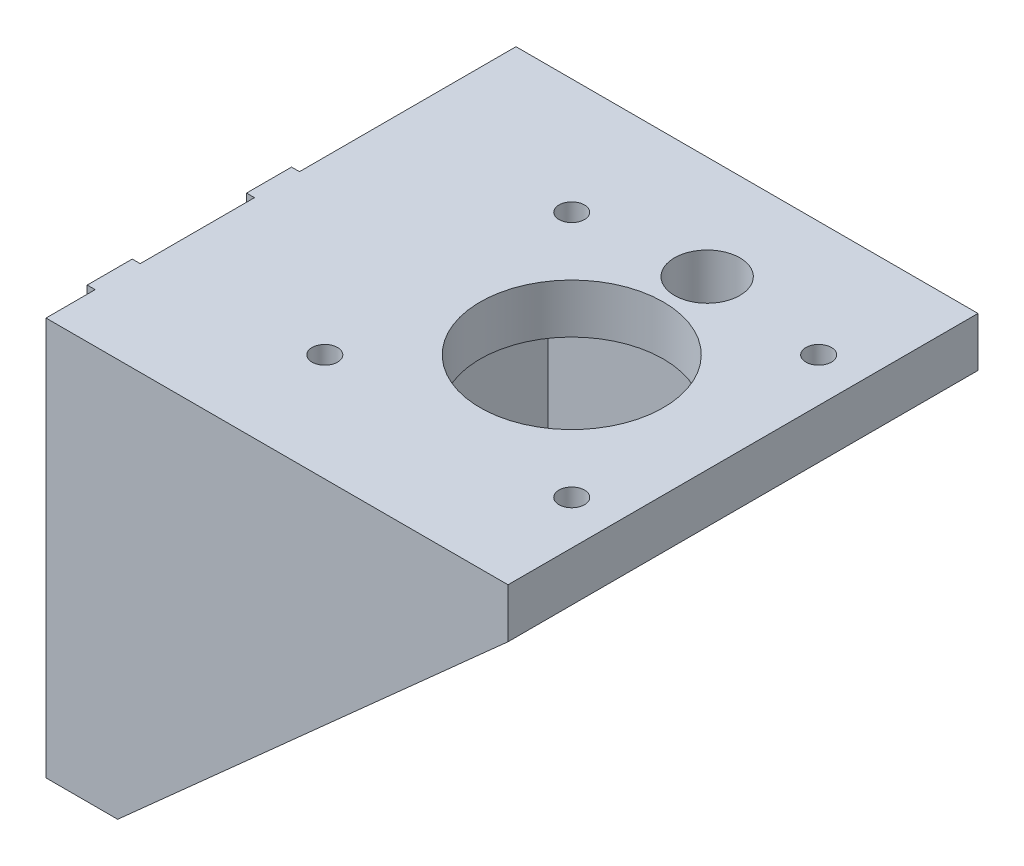
from build123d import *

# Parameters (mm, degrees)
RESSALTO_EXTRUS_O1_DEPTH = 59
ESBO_O2_W                = 50
ESBO_O2_H                = 43.8
CORTE_EXTRUS_O1_DEPTH    = 49
ESBO_O3_R                = 1.75
CORTE_EXTRUS_O2_DEPTH    = 92.553263186
ESBO_O4_W                = 5.65
ESBO_O4_H                = 50
ESBO_O4_R                = 1.75
RESSALTO_EXTRUS_O2_DEPTH = 1
ESBO_O5_R                = 4.35
CORTE_EXTRUS_O3_DEPTH    = 4
ESBO_O6_R                = 11.5
ESBO_O6_R_2              = 1.6
ESBO_O6_R_3              = 4.1
CORTE_EXTRUS_O4_DEPTH    = 6.2
ESBO_O7_W                = 146.645029728
ESBO_O7_H                = 95.479941405
CORTE_EXTRUS_O5_DEPTH    = 139


with BuildPart() as part:
    # Esboço1 → Ressalto-extrusão1 (new body)
    with BuildSketch(Plane.XY):
        Polygon((9, 0), (58, 43.8), (58, 50), (0, 50), (0, 0), align=None)
    extrude(amount=RESSALTO_EXTRUS_O1_DEPTH)

    # Esboço2 → Corte-extrusão1 (cut)
    with BuildSketch(Plane(origin=(58, 0, 0), x_dir=(0, 0, -1), z_dir=(1, 0, 0))):
        with Locations((-29, 21.9)):
            Rectangle(ESBO_O2_W, ESBO_O2_H)
    extrude(amount=-CORTE_EXTRUS_O1_DEPTH, mode=Mode.SUBTRACT)

    # Esboço3 → Corte-extrusão2 (cut, through all)
    with BuildSketch(Plane(origin=(9, 0, 0), x_dir=(0, 0, -1), z_dir=(1, 0, 0))):
        with Locations((-29, 11.9)):
            Circle(ESBO_O3_R)
        with Locations((-29, 31.9)):
            Circle(ESBO_O3_R)
        with Locations((-9, 31.9)):
            Circle(ESBO_O3_R)
        with Locations((-9, 11.9)):
            Circle(ESBO_O3_R)
    extrude(amount=-CORTE_EXTRUS_O2_DEPTH, mode=Mode.SUBTRACT)

    # Esboço4 → Ressalto-extrusão2 (add)
    # profile 1 of 2: a face of its own
    with BuildSketch(Plane.ZY):
        with Locations((9, 25)):
            Rectangle(ESBO_O4_W, ESBO_O4_H)
        with Locations(Location((9, 11.9, 0), (0, 0, 180))):
            Circle(ESBO_O4_R, mode=Mode.SUBTRACT)
        with Locations(Location((9, 31.9, 0), (0, 0, 180))):
            Circle(ESBO_O4_R, mode=Mode.SUBTRACT)
    # profile 2 of 2: a face of its own
    with BuildSketch(Plane.ZY):
        with Locations((29, 25)):
            Rectangle(ESBO_O4_W, ESBO_O4_H)
        with Locations(Location((29, 11.9, 0), (0, 0, 180))):
            Circle(ESBO_O4_R, mode=Mode.SUBTRACT)
        with Locations(Location((29, 31.9, 0), (0, 0, 180))):
            Circle(ESBO_O4_R, mode=Mode.SUBTRACT)
    extrude(amount=RESSALTO_EXTRUS_O2_DEPTH)

    # Esboço5 → Corte-extrusão3 (cut)
    with BuildSketch(Plane(origin=(9, 0, 0), x_dir=(0, 0, -1), z_dir=(1, 0, 0))):
        with Locations((-29, 31.9)):
            Circle(ESBO_O5_R)
        with Locations((-9, 31.9)):
            Circle(ESBO_O5_R)
        with Locations((-29, 11.9)):
            Circle(ESBO_O5_R)
        with Locations((-9, 11.9)):
            Circle(ESBO_O5_R)
    extrude(amount=-CORTE_EXTRUS_O3_DEPTH, mode=Mode.SUBTRACT)

    # Esboço6 → Corte-extrusão4 (cut)
    with BuildSketch(Plane(origin=(0, 50, 0), x_dir=(1, 0, 0), z_dir=(0, 1, 0))):
        with Locations(Location((37, -29, 0), (0, 0, 270))):
            Circle(ESBO_O6_R)
        with Locations(Location((21.5, -13.5, 0), (0, 0, 270))):
            Circle(ESBO_O6_R_2)
        with Locations(Location((52.5, -13.5, 0), (0, 0, 270))):
            Circle(ESBO_O6_R_2)
        with Locations(Location((52.5, -44.5, 0), (0, 0, 270))):
            Circle(ESBO_O6_R_2)
        with Locations(Location((21.5, -44.5, 0), (0, 0, 270))):
            Circle(ESBO_O6_R_2)
        with Locations(Location((37, -46, 0), (0, 0, 270))):
            Circle(ESBO_O6_R_3)
    extrude(amount=-CORTE_EXTRUS_O4_DEPTH, mode=Mode.SUBTRACT)


with BuildPart() as body_2:
    # Espelhar2: mirrored copy
    add(part.part.mirror(Plane(origin=(0, 0, -10), x_dir=(1, 0, 0), z_dir=(0, 0, -1))))


with BuildPart() as part_1:
    add(part.part)

    # Esboço7 → Corte-extrusão5 (cut)
    with BuildSketch(Plane(origin=(0, 0, -10), x_dir=(-1, 0, 0), z_dir=(0, 0, -1))):
        with Locations((-17.98187812, 24.060524641)):
            Rectangle(ESBO_O7_W, ESBO_O7_H)
    extrude(amount=-CORTE_EXTRUS_O5_DEPTH, mode=Mode.SUBTRACT)


solid = body_2.part
